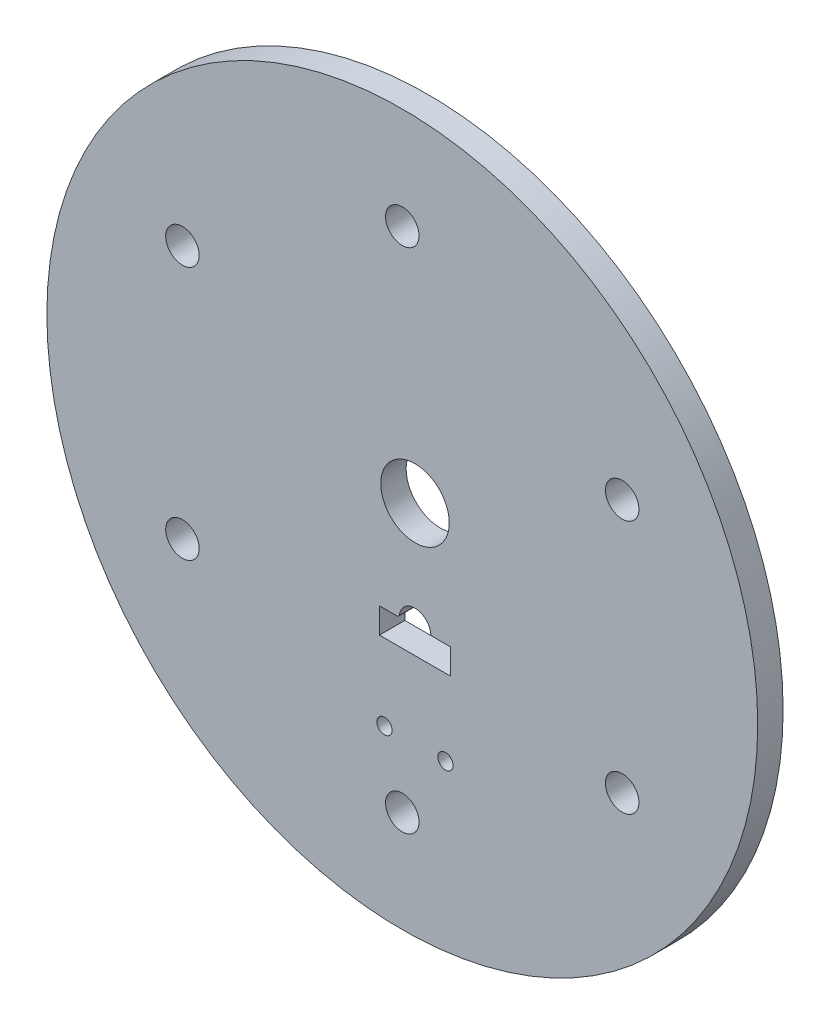
from build123d import *

# Parameters (mm, degrees)
SKETCH1_R               = 70
BOSS_EXTRUDE1_DEPTH     = 5
SKETCH4_R               = 3
CUT_EXTRUDE2_DEPTH      = 100.121138008
CIRPATTERN1_COUNT       = 6
M6_CLEARANCE_HOLE1_D    = 6.6
SKETCH7_W               = 14
SKETCH7_H               = 5
CUT_EXTRUDE3_DEPTH      = 100.121138008
SKETCH8_R               = 1
SKETCH8_R_2             = 3.1
CUT_EXTRUDE4_DEPTH      = 100.121138008
F_1_2_CLEARANCE_HOLE1_D = 13.49248
FILLET1_R               = 0.5
SKETCH20_R              = 1.5
CUT_EXTRUDE6_DEPTH      = 100.121138008


with BuildPart() as part:
    # Sketch1 → Boss-Extrude1 (new body)
    with BuildSketch(Plane.XY):
        Circle(SKETCH1_R)
    extrude(amount=BOSS_EXTRUDE1_DEPTH)

    # Sketch4 → Cut-Extrude2 (cut, through all)
    with BuildSketch(Plane.XY):
        with Locations((0, 50)):
            Circle(SKETCH4_R)
    cut_extrude2 = extrude(amount=CUT_EXTRUDE2_DEPTH, mode=Mode.SUBTRACT)

    # CirPattern1: Cut-Extrude2 ×6 about axis
    cirpattern1_axis = Axis((0, 0, 0), (0, 0, 1))
    for i in range(1, CIRPATTERN1_COUNT):
        add(cut_extrude2.rotate(cirpattern1_axis, i * 360 / CIRPATTERN1_COUNT), mode=Mode.SUBTRACT)

    # M6 Clearance Hole1 (through all)
    with Locations(Plane.XY.offset(5)):
        with Locations((0, 50), (43.301270189, 25), (43.301270189, -25), (0, -50), (-43.301270189, -25), (-43.301270189, 25)):
            Hole(M6_CLEARANCE_HOLE1_D / 2)

    # Sketch7 → Cut-Extrude3 (cut, through all)
    with BuildSketch(Plane.XY):
        with Locations((2.5, -19.5)):
            Rectangle(SKETCH7_W, SKETCH7_H)
    extrude(amount=CUT_EXTRUDE3_DEPTH, mode=Mode.SUBTRACT)

    # Sketch8 → Cut-Extrude4 (cut, through all)
    with BuildSketch(Plane(origin=(0, 0, 0), x_dir=(-1, 0, 0), z_dir=(0, 0, -1))):
        with Locations((-2.5, 4)):
            Circle(SKETCH8_R)
        with Locations((-2.5, -17)):
            Circle(SKETCH8_R_2)
    extrude(amount=-CUT_EXTRUDE4_DEPTH, mode=Mode.SUBTRACT)

    # 1/2 Clearance Hole1 (through all)
    with Locations(Plane(origin=(0, 0, 0), x_dir=(-1, 0, 0), z_dir=(0, 0, -1))):
        with Locations((-2.5, 4)):
            Hole(F_1_2_CLEARANCE_HOLE1_D / 2)

    # Fillet1
    fillet1_edges = [part.edges().sort_by_distance(p)[0] for p in [
        (5.6, -17, 2.5),
        (-0.6, -17, 2.5),
    ]]
    fillet(fillet1_edges, radius=FILLET1_R)

    # Sketch20 → Cut-Extrude6 (cut, through all)
    with BuildSketch(Plane(origin=(0, 0, 0), x_dir=(-1, 0, 0), z_dir=(0, 0, -1))):
        with Locations((-8.5, -37)):
            Circle(SKETCH20_R)
        with Locations((3.5, -37)):
            Circle(SKETCH20_R)
    extrude(amount=-CUT_EXTRUDE6_DEPTH, mode=Mode.SUBTRACT)


solid = part.part
